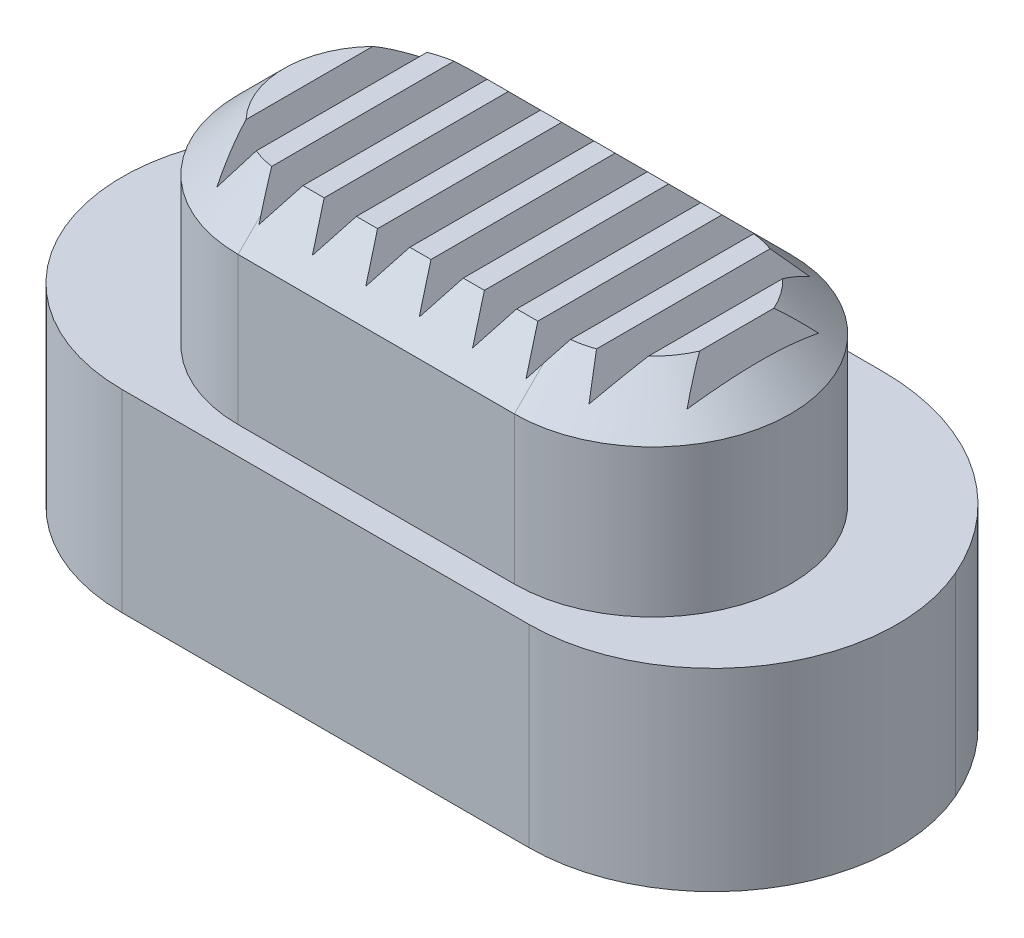
from build123d import *

# Parameters (mm, degrees)
EXTRUDE_1_DEPTH     = 4.2
CUT_EXTRUDE_1_REACH = 15.662
SKETCH_3_R          = 1.75
EXTRUDE_2_DEPTH     = 4.2
CHAMFER_1_SIZE      = 1
CUT_EXTRUDE_2_REACH = 15.662
SKETCH_5_W          = 13.93974063
SKETCH_5_H          = 1.4
FILLET_1_R          = 4
CUT_EXTRUDE_3_REACH = 18.927


with BuildPart() as part:
    # 草图1 → 凸台-拉伸1 (new body)
    with BuildSketch(Plane(origin=(0, 0, 0), x_dir=(1, 0, 0), z_dir=(0, 1, 0))):
        with BuildLine():
            Line((0, 5), (7, 5))
            ThreePointArc((7, 5), (12, 0), (7, -5))
            Line((7, -5), (0, -5))
            ThreePointArc((0, -5), (-5, 0), (0, 5))
        make_face()
    extrude(amount=EXTRUDE_1_DEPTH)

    # 草图3 → 切除-拉伸1 (cut, up to next)
    with BuildSketch(Plane.XZ, mode=Mode.PRIVATE) as cut_extrude_1_sk1:
        with Locations(Location((0, 0, 0), (0, 0, 270))):
            Circle(SKETCH_3_R)
    cut_extrude_1_tool1 = extrude(cut_extrude_1_sk1.sketch, amount=-CUT_EXTRUDE_1_REACH, mode=Mode.PRIVATE) & part.part
    add(cut_extrude_1_tool1.solids().sort_by_distance((0, 0, 0))[0], mode=Mode.SUBTRACT)

    # 草图4 → 凸台-拉伸2 (add)
    with BuildSketch(Plane(origin=(0, 4.2, 0), x_dir=(1, 0, 0), z_dir=(0, 1, 0))):
        with BuildLine():
            Line((1, 3), (7, 3))
            ThreePointArc((7, 3), (10, 0), (7, -3))
            Line((7, -3), (1, -3))
            ThreePointArc((1, -3), (-2, 0), (1, 3))
        make_face()
    extrude(amount=EXTRUDE_2_DEPTH)

    # 倒角1
    chamfer_1_edges = [part.edges().sort_by_distance(p)[0] for p in [
        (-2, 8.4, 0),
        (4, 8.4, 3),
        (10, 8.4, 0),
        (4, 8.4, -3),
    ]]
    chamfer(chamfer_1_edges, length=CHAMFER_1_SIZE)

    # 草图5 → 切除-拉伸2 (cut, up to next)
    with BuildSketch(Plane(origin=(0, 4.2, 0), x_dir=(1, 0, 0), z_dir=(0, 1, 0)), mode=Mode.PRIVATE) as cut_extrude_2_sk1:
        with Locations((3.5, -4.3)):
            Rectangle(SKETCH_5_W, SKETCH_5_H)
    cut_extrude_2_tool1 = extrude(cut_extrude_2_sk1.sketch, amount=-CUT_EXTRUDE_2_REACH, mode=Mode.PRIVATE) & part.part
    add(cut_extrude_2_tool1.solids().sort_by_distance((3.5, 4.2, 4.3))[0], mode=Mode.SUBTRACT)

    # 圆角1
    fillet_1_edges = [part.edges().sort_by_distance(p)[0] for p in [
        (-3.469870315, 2.1, 3.6),
        (10.469870315, 2.1, 3.6),
    ]]
    fillet(fillet_1_edges, radius=FILLET_1_R)

    # 草图6 → 切除-拉伸3 (cut, up to next)
    with BuildSketch(Plane.XY.offset(3.6), mode=Mode.PRIVATE) as cut_extrude_3_sk1:
        Polygon((-0.45, 8.4), (-0.1, 7.793782217), (0.25, 8.4), align=None)
    cut_extrude_3_tool1 = extrude(cut_extrude_3_sk1.sketch, amount=-CUT_EXTRUDE_3_REACH, mode=Mode.PRIVATE) & part.part
    # 草图6 → 切除-拉伸3 (cut, up to next)
    with BuildSketch(Plane.XY.offset(3.6), mode=Mode.PRIVATE) as cut_extrude_3_sk2:
        Polygon((1.41, 8.4), (0.71, 8.4), (1.06, 7.793782217), align=None)
    cut_extrude_3_tool2 = extrude(cut_extrude_3_sk2.sketch, amount=-CUT_EXTRUDE_3_REACH, mode=Mode.PRIVATE) & part.part
    # 草图6 → 切除-拉伸3 (cut, up to next)
    with BuildSketch(Plane.XY.offset(3.6), mode=Mode.PRIVATE) as cut_extrude_3_sk3:
        Polygon((2.57, 8.4), (1.87, 8.4), (2.22, 7.793782217), align=None)
    cut_extrude_3_tool3 = extrude(cut_extrude_3_sk3.sketch, amount=-CUT_EXTRUDE_3_REACH, mode=Mode.PRIVATE) & part.part
    # 草图6 → 切除-拉伸3 (cut, up to next)
    with BuildSketch(Plane.XY.offset(3.6), mode=Mode.PRIVATE) as cut_extrude_3_sk4:
        Polygon((3.73, 8.4), (3.03, 8.4), (3.38, 7.793782217), align=None)
    cut_extrude_3_tool4 = extrude(cut_extrude_3_sk4.sketch, amount=-CUT_EXTRUDE_3_REACH, mode=Mode.PRIVATE) & part.part
    # 草图6 → 切除-拉伸3 (cut, up to next)
    with BuildSketch(Plane.XY.offset(3.6), mode=Mode.PRIVATE) as cut_extrude_3_sk5:
        Polygon((4.89, 8.4), (4.19, 8.4), (4.54, 7.793782217), align=None)
    cut_extrude_3_tool5 = extrude(cut_extrude_3_sk5.sketch, amount=-CUT_EXTRUDE_3_REACH, mode=Mode.PRIVATE) & part.part
    # 草图6 → 切除-拉伸3 (cut, up to next)
    with BuildSketch(Plane.XY.offset(3.6), mode=Mode.PRIVATE) as cut_extrude_3_sk6:
        Polygon((6.05, 8.4), (5.35, 8.4), (5.7, 7.793782217), align=None)
    cut_extrude_3_tool6 = extrude(cut_extrude_3_sk6.sketch, amount=-CUT_EXTRUDE_3_REACH, mode=Mode.PRIVATE) & part.part
    # 草图6 → 切除-拉伸3 (cut, up to next)
    with BuildSketch(Plane.XY.offset(3.6), mode=Mode.PRIVATE) as cut_extrude_3_sk7:
        Polygon((7.21, 8.4), (6.51, 8.4), (6.86, 7.793782217), align=None)
    cut_extrude_3_tool7 = extrude(cut_extrude_3_sk7.sketch, amount=-CUT_EXTRUDE_3_REACH, mode=Mode.PRIVATE) & part.part
    # 草图6 → 切除-拉伸3 (cut, up to next)
    with BuildSketch(Plane.XY.offset(3.6), mode=Mode.PRIVATE) as cut_extrude_3_sk8:
        Polygon((8.37, 8.4), (7.67, 8.4), (8.02, 7.793782217), align=None)
    cut_extrude_3_tool8 = extrude(cut_extrude_3_sk8.sketch, amount=-CUT_EXTRUDE_3_REACH, mode=Mode.PRIVATE) & part.part
    # 草图6 → 切除-拉伸3 (cut, up to next)
    with BuildSketch(Plane.XY.offset(3.6), mode=Mode.PRIVATE) as cut_extrude_3_sk9:
        Polygon((9.53, 8.4), (8.83, 8.4), (9.18, 7.793782217), align=None)
    cut_extrude_3_tool9 = extrude(cut_extrude_3_sk9.sketch, amount=-CUT_EXTRUDE_3_REACH, mode=Mode.PRIVATE) & part.part
    add(cut_extrude_3_tool1.solids().sort_by_distance((-0.1, 8.197927, 3.6))[0], mode=Mode.SUBTRACT)
    add(cut_extrude_3_tool2.solids().sort_by_distance((1.06, 8.197927, 3.6))[0], mode=Mode.SUBTRACT)
    add(cut_extrude_3_tool3.solids().sort_by_distance((2.22, 8.197927, 3.6))[0], mode=Mode.SUBTRACT)
    add(cut_extrude_3_tool4.solids().sort_by_distance((3.38, 8.197927, 3.6))[0], mode=Mode.SUBTRACT)
    add(cut_extrude_3_tool5.solids().sort_by_distance((4.54, 8.197927, 3.6))[0], mode=Mode.SUBTRACT)
    add(cut_extrude_3_tool6.solids().sort_by_distance((5.7, 8.197927, 3.6))[0], mode=Mode.SUBTRACT)
    add(cut_extrude_3_tool7.solids().sort_by_distance((6.86, 8.197927, 3.6))[0], mode=Mode.SUBTRACT)
    add(cut_extrude_3_tool8.solids().sort_by_distance((8.02, 8.197927, 3.6))[0], mode=Mode.SUBTRACT)
    add(cut_extrude_3_tool9.solids().sort_by_distance((9.18, 8.197927, 3.6))[0], mode=Mode.SUBTRACT)


solid = part.part
